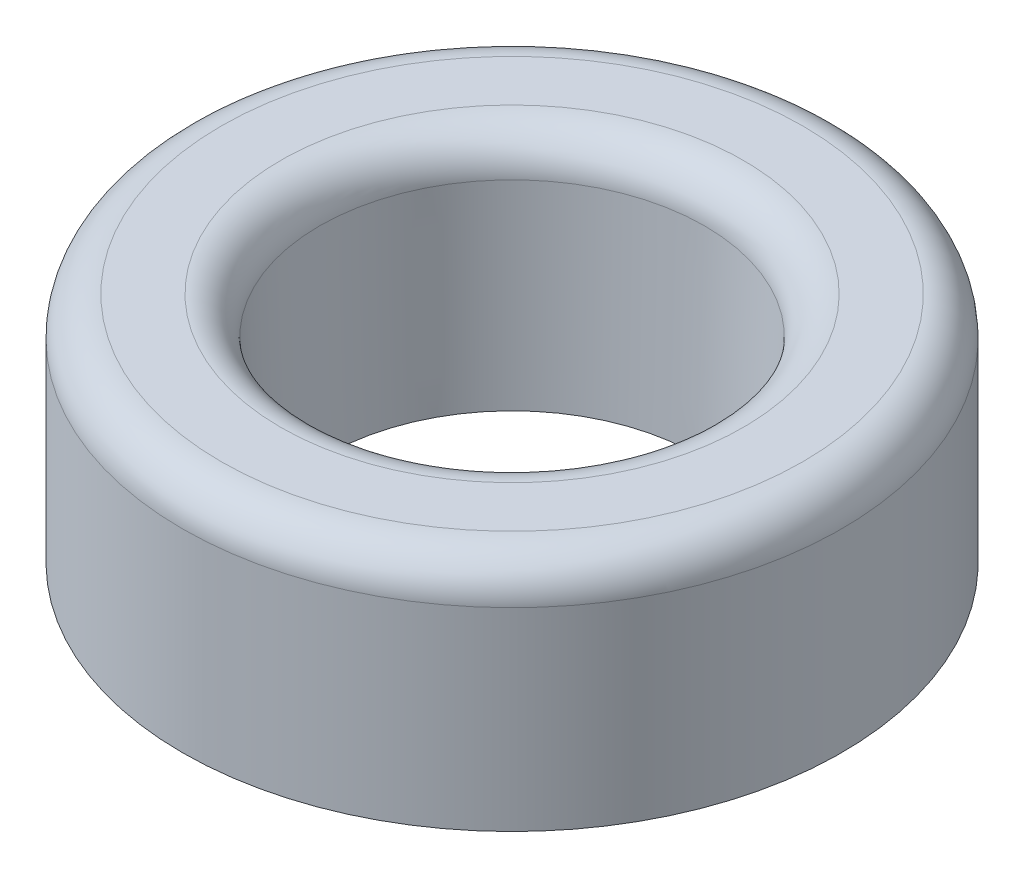
from build123d import *

# Parameters (mm, degrees)
SKETCH1_R           = 8.5
BOSS_EXTRUDE1_DEPTH = 6
FILLET2_R           = 1
SKETCH2_R           = 5
CUT_EXTRUDE4_DEPTH  = 6
CUT_EXTRUDE4_DRAFT  = -2
FILLET5_R           = 1


with BuildPart() as part:
    # Sketch1 → Boss-Extrude1 (new body)
    with BuildSketch(Plane(origin=(0, 0, 0), x_dir=(1, 0, 0), z_dir=(0, 1, 0))):
        with Locations(Location((-51.120170416, 0, 0), (0, 0, 270))):
            Circle(SKETCH1_R)
    extrude(amount=BOSS_EXTRUDE1_DEPTH)

    # Fillet2
    fillet2_edges = [part.edges().sort_by_distance(p)[0] for p in [
        (-51.120170416, 6, -8.5),
    ]]
    fillet(fillet2_edges, radius=FILLET2_R)


with BuildPart() as cut_extrude4_tool:
    # Sketch2 → Cut-Extrude4 (with draft: the straight prism first)
    with BuildSketch(Plane(origin=(0, 6, 0), x_dir=(1, 0, 0), z_dir=(0, 1, 0))):
        with Locations((-51.120170416, 0)):
            Circle(SKETCH2_R)
    extrude(amount=-CUT_EXTRUDE4_DEPTH)
    # Cut-Extrude4: the draft: its side faces are tilted about the plane it starts from
    cut_extrude4_sides = [cut_extrude4_tool.faces().sort_by_distance(p)[0] for p in [
        (-56.120170416, 3, 0),
    ]]
    draft(cut_extrude4_sides, Plane(origin=(0, 6, 0), x_dir=(1, 0, 0), z_dir=(0, 1, 0)), CUT_EXTRUDE4_DRAFT)


with BuildPart() as part_1:
    add(part.part)

    # Cut-Extrude4: cut by cut_extrude4_tool
    add(cut_extrude4_tool.part, mode=Mode.SUBTRACT)

    # Fillet5
    fillet5_edges = [part_1.edges().sort_by_distance(p)[0] for p in [
        (-56.120170416, 6, 0),
    ]]
    fillet(fillet5_edges, radius=FILLET5_R)


solid = part_1.part
